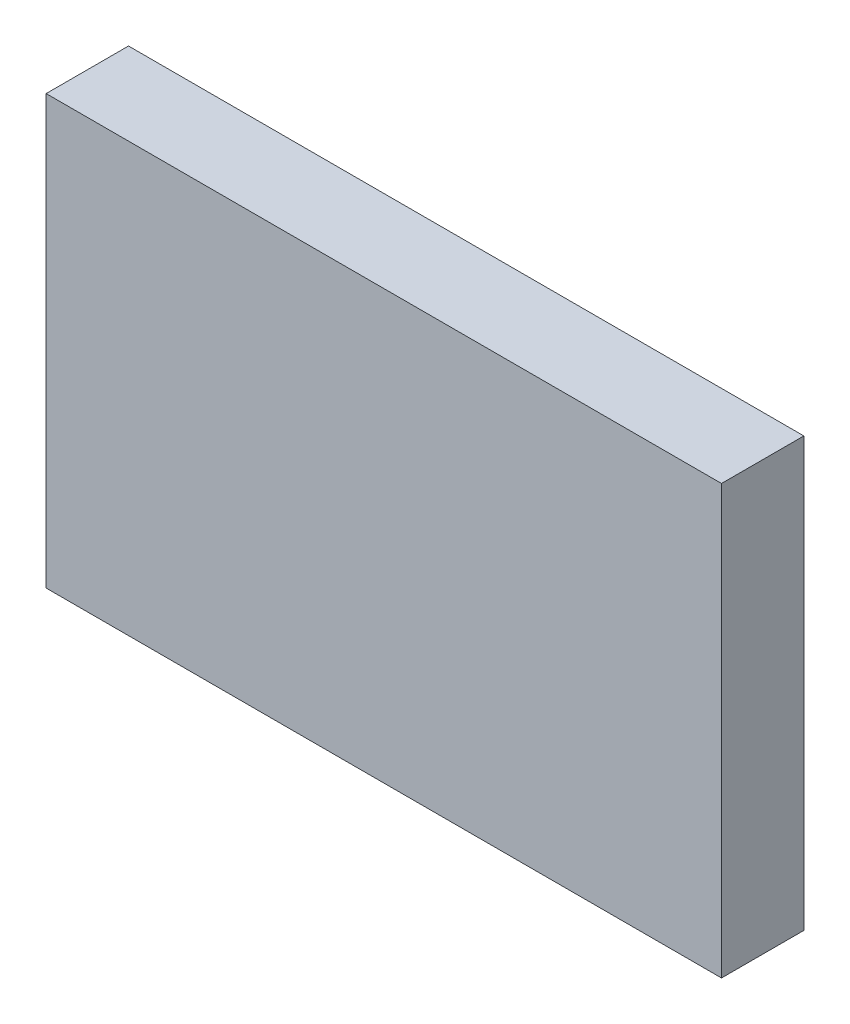
from build123d import *

# Parameters (mm, degrees)
SKETCH1_W           = 82
SKETCH1_H           = 52
BOSS_EXTRUDE1_DEPTH = 10


with BuildPart() as part:
    # Sketch1 → Boss-Extrude1 (new body)
    with BuildSketch(Plane.XY):
        Rectangle(SKETCH1_W, SKETCH1_H)
    extrude(amount=BOSS_EXTRUDE1_DEPTH)


solid = part.part
